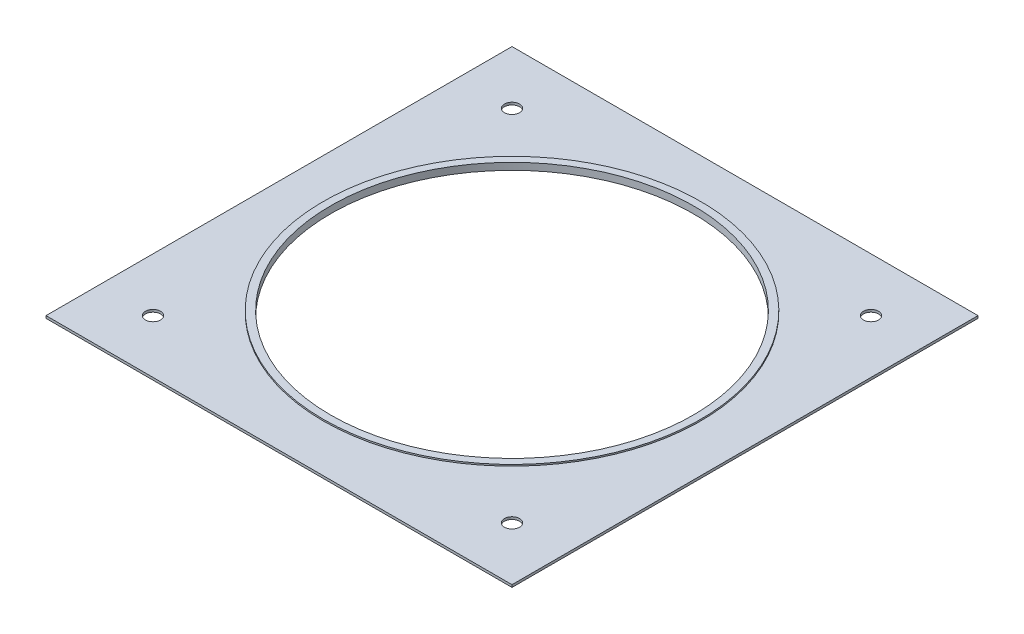
from build123d import *

# Parameters (mm, degrees)
CROQUIS1_W              = 154.2
CROQUIS1_H              = 154.2
SALIENTE_EXTRUIR1_DEPTH = 0.8
CROQUIS2_R              = 60
CORTAR_EXTRUIR1_DEPTH   = 110.038800434
SALIENTE_EXTRUIR2_START = 1
CROQUIS3_R              = 60.995810587
CROQUIS3_R_2            = 60
SALIENTE_EXTRUIR2_DEPTH = 1
SALIENTE_EXTRUIR3_START = 0.5
CROQUIS4_R              = 62.434019261
CROQUIS4_R_2            = 60
SALIENTE_EXTRUIR3_DEPTH = 0.5
CROQUIS5_R              = 2.5
CROQUIS5_R_2            = 60
CORTAR_EXTRUIR2_DEPTH   = 110.046182877


with BuildPart() as part:
    # Croquis1 → Saliente-Extruir1 (new body)
    with BuildSketch(Plane(origin=(0, 0, 0), x_dir=(1, 0, 0), z_dir=(0, 1, 0))):
        Rectangle(CROQUIS1_W, CROQUIS1_H)
    extrude(amount=SALIENTE_EXTRUIR1_DEPTH)

    # Croquis2 → Cortar-Extruir1 (cut, through all)
    with BuildSketch(Plane(origin=(0, 0.8, 0), x_dir=(1, 0, 0), z_dir=(0, 1, 0))):
        with Locations(Location((0, 0, 0), (0, 0, 270))):
            Circle(CROQUIS2_R)
    extrude(amount=-CORTAR_EXTRUIR1_DEPTH, mode=Mode.SUBTRACT)

    # Croquis3 → Saliente-Extruir2 (add)
    with BuildSketch(Plane(origin=(0, 0.8, 0), x_dir=(1, 0, 0), z_dir=(0, 1, 0)).offset(SALIENTE_EXTRUIR2_START)):
        with Locations(Location((0, 0, 0), (0, 0, 90))):
            Circle(CROQUIS3_R)
        with Locations(Location((0, 0, 0), (0, 0, 270))):
            Circle(CROQUIS3_R_2, mode=Mode.SUBTRACT)
    extrude(amount=-SALIENTE_EXTRUIR2_DEPTH)

    # Croquis4 → Saliente-Extruir3 (add)
    with BuildSketch(Plane(origin=(0, 1.8, 0), x_dir=(1, 0, 0), z_dir=(0, 1, 0)).offset(SALIENTE_EXTRUIR3_START)):
        with Locations(Location((0, 0, 0), (0, 0, 270))):
            Circle(CROQUIS4_R)
        with Locations(Location((0, 0, 0), (0, 0, 270))):
            Circle(CROQUIS4_R_2, mode=Mode.SUBTRACT)
    extrude(amount=-SALIENTE_EXTRUIR3_DEPTH)

    # Croquis5 → Cortar-Extruir2 (cut, through all)
    with BuildSketch(Plane(origin=(0, 0.8, 0), x_dir=(1, 0, 0), z_dir=(0, 1, 0))):
        with Locations(Location((-59.39696962, 59.39696962, 0), (0, 0, 270))):
            Circle(CROQUIS5_R)
        with Locations(Location((-59.39696962, -59.39696962, 0), (0, 0, 90))):
            Circle(CROQUIS5_R)
        with Locations(Location((59.39696962, -59.39696962, 0), (0, 0, 270))):
            Circle(CROQUIS5_R)
        with Locations(Location((0, 0, 0), (0, 0, 270))):
            Circle(CROQUIS5_R_2)
        with Locations(Location((59.39696962, 59.39696962, 0), (0, 0, 90))):
            Circle(CROQUIS5_R)
    extrude(amount=-CORTAR_EXTRUIR2_DEPTH, mode=Mode.SUBTRACT)


solid = part.part
